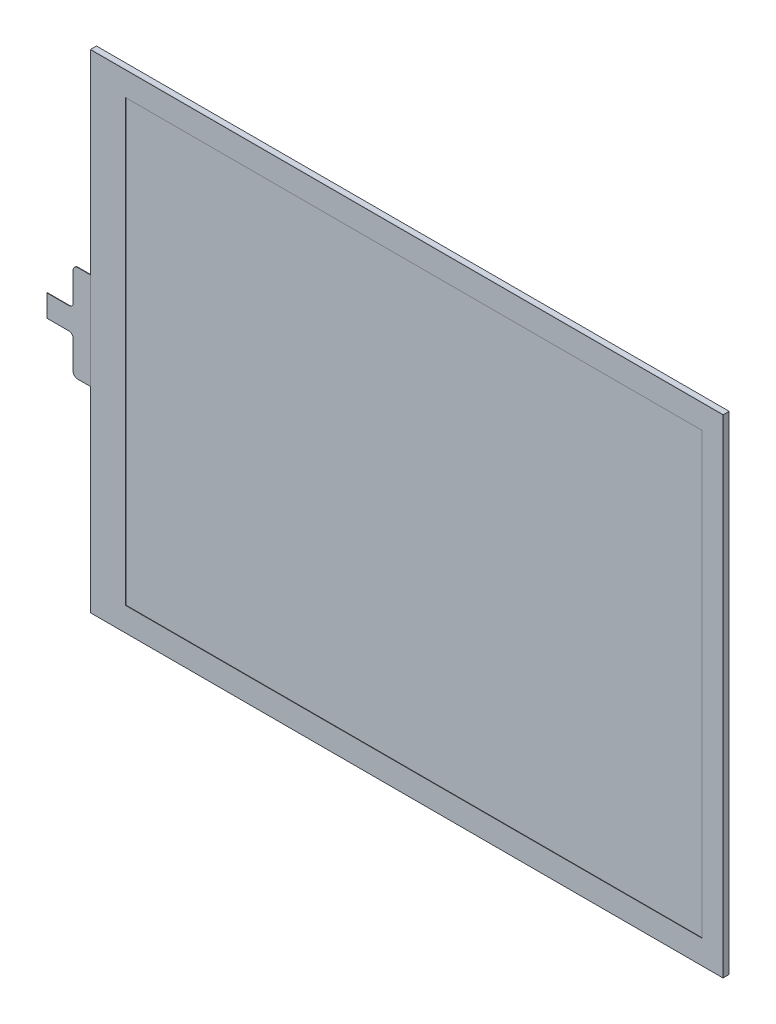
from build123d import *

# Parameters (mm, degrees)
SKETCH1_W           = 144
SKETCH1_H           = 111
BOSS_EXTRUDE1_DEPTH = 1.3
BOSS_EXTRUDE2_DEPTH = 0.1
SKETCH5_W           = 131.2
SKETCH5_H           = 100.1
BOSS_EXTRUDE3_DEPTH = 0.1


with BuildPart() as part:
    # Sketch1 → Boss-Extrude1 (new body)
    with BuildSketch(Plane.XY):
        with Locations((72, 55.5)):
            Rectangle(SKETCH1_W, SKETCH1_H)
    extrude(amount=BOSS_EXTRUDE1_DEPTH)

    # Sketch2 → Boss-Extrude2 (add)
    with BuildSketch(Plane.XY.offset(1.3)):
        with BuildLine():
            Line((0, 66.5), (-3, 66.5))
            ThreePointArc((-3, 66.5), (-3.707106781, 66.207106781), (-4, 65.5))
            Line((-4, 65.5), (-4, 59))
            ThreePointArc((-4, 59), (-4.292893219, 58.292893219), (-5, 58))
            Line((-5, 58), (-10, 58))
            Line((-10, 58), (-10, 53))
            Line((-10, 53), (-5, 53))
            ThreePointArc((-5, 53), (-4.292893219, 52.707106781), (-4, 52))
            Line((-4, 52), (-4, 45.5))
            ThreePointArc((-4, 45.5), (-3.707106781, 44.792893219), (-3, 44.5))
            Line((-3, 44.5), (0, 44.5))
            Line((0, 44.5), (0, 66.5))
        make_face()
    extrude(amount=-BOSS_EXTRUDE2_DEPTH)


with BuildPart() as body_2:
    # Sketch5 → Boss-Extrude3 (new body)
    with BuildSketch(Plane.XY.offset(1.3)):
        Polygon((144, 111), (0, 111), (0, 66.5), (0, 44.5), (0, 0), (144, 0), align=None)
        with Locations((73.6, 55.5)):
            Rectangle(SKETCH5_W, SKETCH5_H, mode=Mode.SUBTRACT)
    extrude(amount=BOSS_EXTRUDE3_DEPTH)


solid = Compound([part.part, body_2.part])
